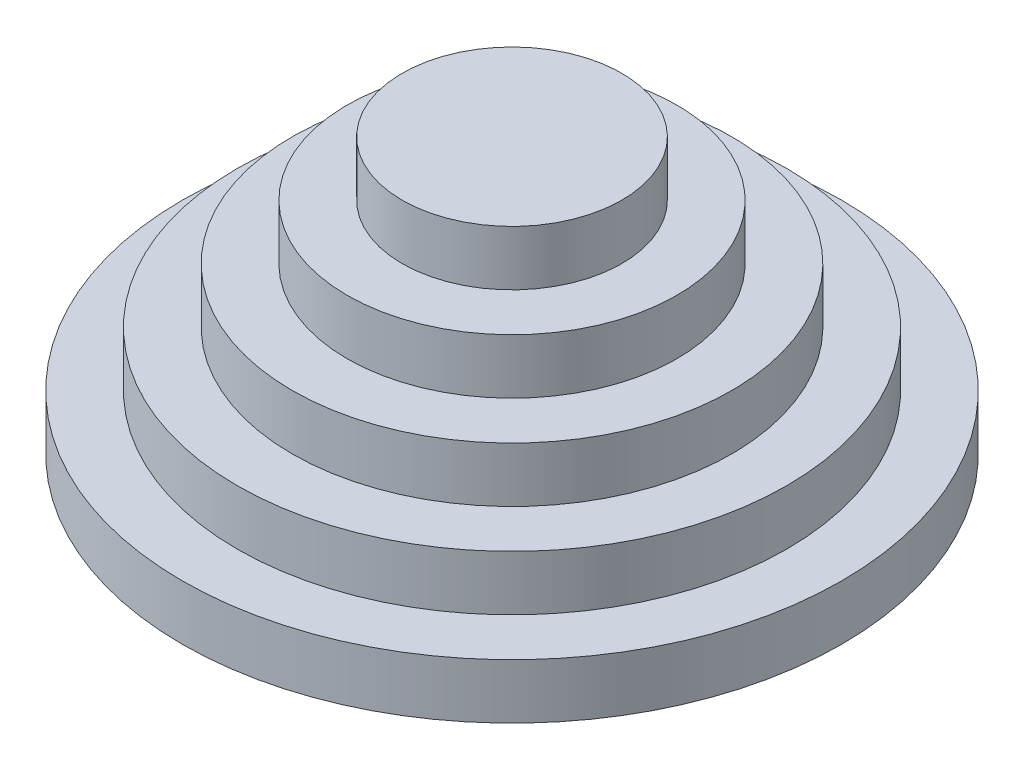
from build123d import *

# Parameters (mm, degrees)
SCHIZZO1_R                   = 25
ESTRUSIONE_ESTRUSIONE1_DEPTH = 5
SCHIZZO2_R                   = 20
ESTRUSIONE_ESTRUSIONE2_DEPTH = 5
SCHIZZO3_R                   = 15
ESTRUSIONE_ESTRUSIONE3_DEPTH = 5
SCHIZZO4_R                   = 10
ESTRUSIONE_ESTRUSIONE4_DEPTH = 5
SCHIZZO6_R                   = 30
ESTRUSIONE_ESTRUSIONE6_DEPTH = 5


with BuildPart() as part:
    # Schizzo1 → Estrusione-Estrusione1 (new body)
    with BuildSketch(Plane(origin=(0, 0, 0), x_dir=(1, 0, 0), z_dir=(0, 1, 0))):
        with Locations(Location((0, 0, 0), (0, 0, 270))):
            Circle(SCHIZZO1_R)
    extrude(amount=ESTRUSIONE_ESTRUSIONE1_DEPTH)

    # Schizzo2 → Estrusione-Estrusione2 (add)
    with BuildSketch(Plane(origin=(0, 5, 0), x_dir=(1, 0, 0), z_dir=(0, 1, 0))):
        with Locations(Location((0, 0, 0), (0, 0, 270))):
            Circle(SCHIZZO2_R)
    extrude(amount=ESTRUSIONE_ESTRUSIONE2_DEPTH)

    # Schizzo3 → Estrusione-Estrusione3 (add)
    with BuildSketch(Plane(origin=(0, 10, 0), x_dir=(1, 0, 0), z_dir=(0, 1, 0))):
        with Locations(Location((0, 0, 0), (0, 0, 270))):
            Circle(SCHIZZO3_R)
    extrude(amount=ESTRUSIONE_ESTRUSIONE3_DEPTH)

    # Schizzo4 → Estrusione-Estrusione4 (add)
    with BuildSketch(Plane(origin=(0, 15, 0), x_dir=(1, 0, 0), z_dir=(0, 1, 0))):
        with Locations(Location((0, 0, 0), (0, 0, 270))):
            Circle(SCHIZZO4_R)
    extrude(amount=ESTRUSIONE_ESTRUSIONE4_DEPTH)

    # Schizzo6 → Estrusione-Estrusione6 (add)
    with BuildSketch(Plane.XZ):
        with Locations(Location((0, 0, 0), (0, 0, 270))):
            Circle(SCHIZZO6_R)
    extrude(amount=ESTRUSIONE_ESTRUSIONE6_DEPTH)


solid = part.part
